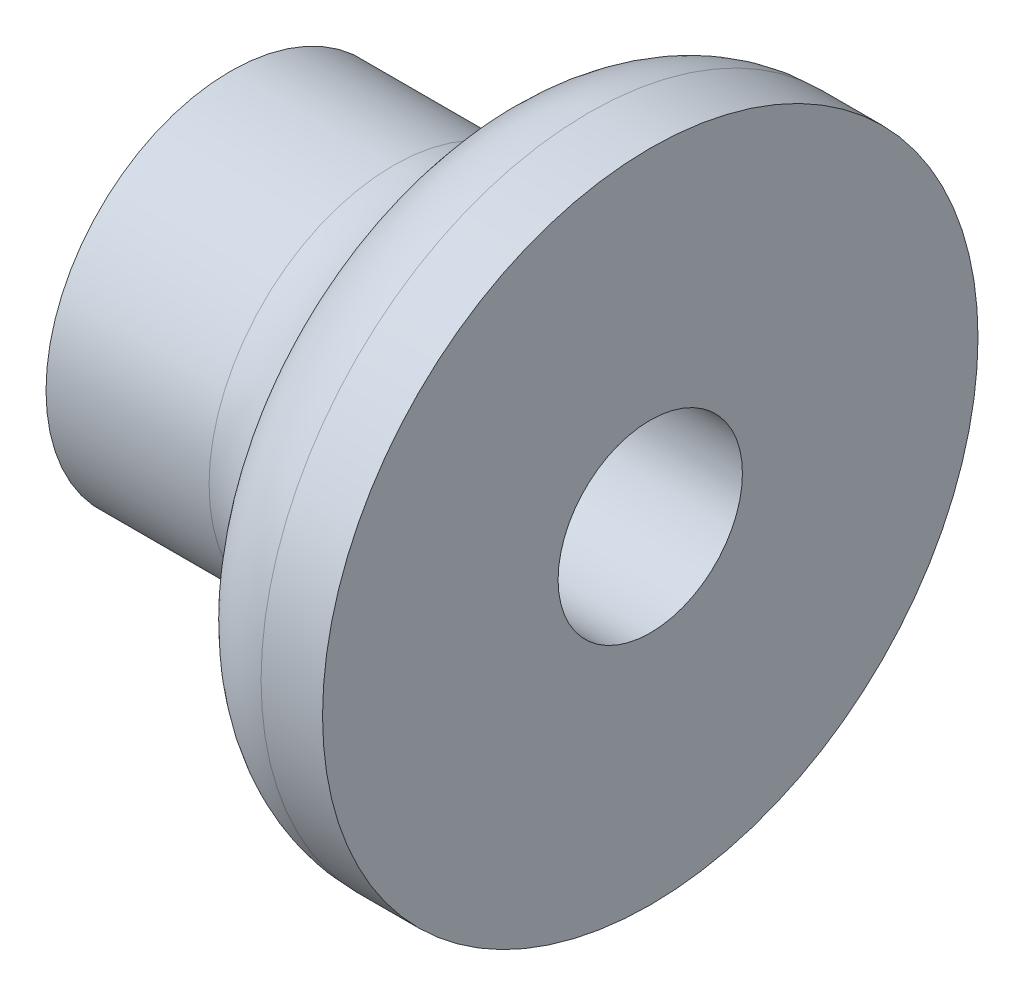
from build123d import *

# Parameters (mm, degrees)
SKETCH1_R           = 4.5
BOSS_EXTRUDE1_DEPTH = 10.25
SKETCH3_R           = 2.250000008
CUT_EXTRUDE1_DEPTH  = 34
BOSS_EXTRUDE2_START = -4
SKETCH4_R           = 8
SKETCH4_R_2         = 4.5
BOSS_EXTRUDE2_DEPTH = 4
FILLET1_R           = 2.5
FILLET2_R           = 2.5


with BuildPart() as part:
    # Sketch1 → Boss-Extrude1 (new body)
    with BuildSketch(Plane(origin=(0, 0, 0), x_dir=(0, 0, -1), z_dir=(1, 0, 0))):
        Circle(SKETCH1_R)
    extrude(amount=BOSS_EXTRUDE1_DEPTH)

    # Sketch3 → Cut-Extrude1 (cut)
    with BuildSketch(Plane.ZY):
        Circle(SKETCH3_R)
    extrude(amount=-CUT_EXTRUDE1_DEPTH, mode=Mode.SUBTRACT)

    # Sketch4 → Boss-Extrude2 (add)
    with BuildSketch(Plane(origin=(10.25, 0, 0), x_dir=(0, 0, -1), z_dir=(1, 0, 0)).offset(BOSS_EXTRUDE2_START)):
        Circle(SKETCH4_R)
        Circle(SKETCH4_R_2, mode=Mode.SUBTRACT)
    extrude(amount=BOSS_EXTRUDE2_DEPTH)

    # Fillet1
    fillet1_edges = [part.edges().sort_by_distance(p)[0] for p in [
        (6.25, 0, 8),
    ]]
    fillet(fillet1_edges, radius=FILLET1_R)

    # Fillet2
    fillet2_edges = [part.edges().sort_by_distance(p)[0] for p in [
        (6.25, 0, 4.5),
    ]]
    fillet(fillet2_edges, radius=FILLET2_R)


solid = part.part
